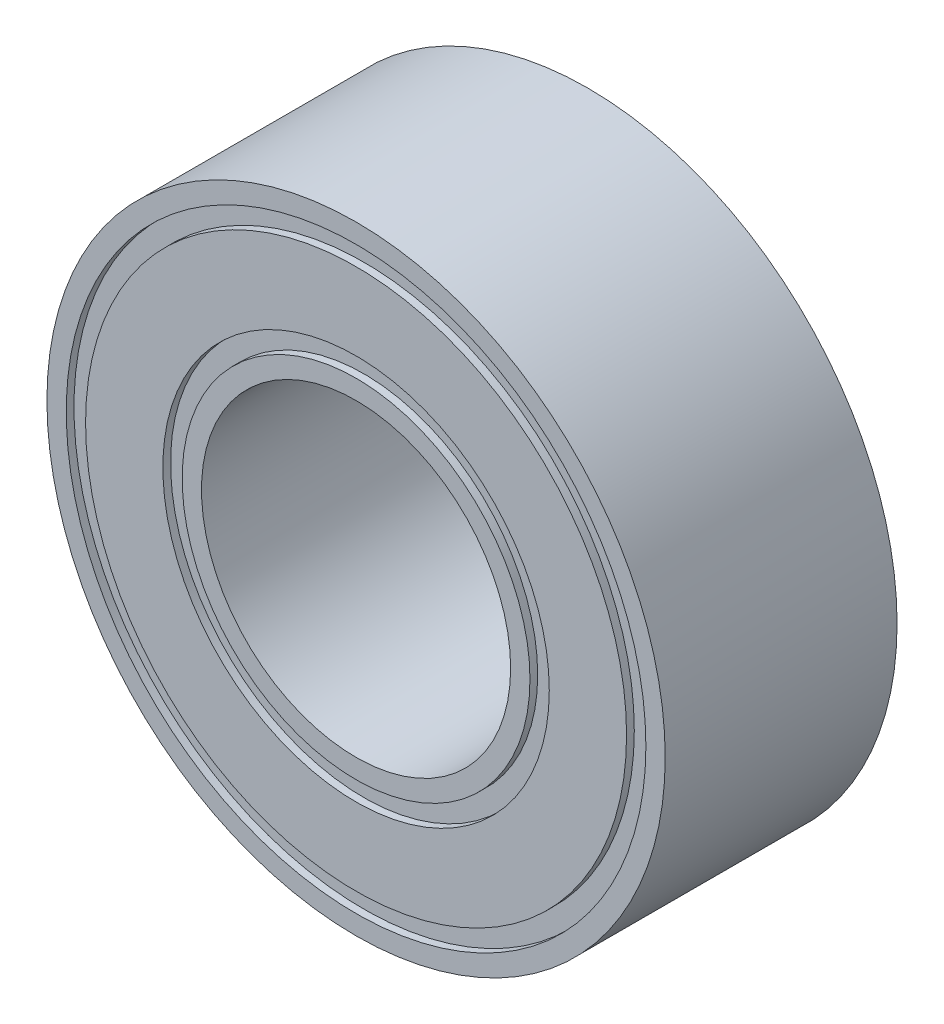
from build123d import *

# Parameters (mm, degrees)
SKETCH_1_R          = 4
SKETCH_1_R_2        = 2
EXTRUDE_1_DEPTH     = 3
SKETCH_2_R          = 3.75
SKETCH_2_R_2        = 3.5
SKETCH_2_R_3        = 2.5
SKETCH_2_R_4        = 2.25
CUT_EXTRUDE_1_DEPTH = 0.1
CUT_EXTRUDE_START   = -0.1
SKETCH_3_R          = 3.75
SKETCH_3_R_2        = 3.5
SKETCH_3_R_3        = 2.5
SKETCH_3_R_4        = 2.25
CUT_EXTRUDE_2_DEPTH = 0.1


with BuildPart() as part:
    # 草图1 → 凸台-拉伸1 (new body)
    with BuildSketch(Plane.XY):
        Circle(SKETCH_1_R)
        Circle(SKETCH_1_R_2, mode=Mode.SUBTRACT)
    extrude(amount=EXTRUDE_1_DEPTH)

    # 草图2 → 切除-拉伸1 (cut)
    # profile 1 of 2: a face of its own
    with BuildSketch(Plane.XY.offset(3)):
        Circle(SKETCH_2_R)
        Circle(SKETCH_2_R_2, mode=Mode.SUBTRACT)
    # profile 2 of 2: a face of its own
    with BuildSketch(Plane.XY.offset(3)):
        Circle(SKETCH_2_R_3)
        Circle(SKETCH_2_R_4, mode=Mode.SUBTRACT)
    extrude(amount=-CUT_EXTRUDE_1_DEPTH, mode=Mode.SUBTRACT)

    # 草图3 → 切除-拉伸2 (cut)
    # profile 1 of 2: a face of its own
    with BuildSketch(Plane(origin=(0, 0, 0), x_dir=(-1, 0, 0), z_dir=(0, 0, -1)).offset(CUT_EXTRUDE_START)):
        with Locations(Location((0, 0, 0), (0, 0, 180))):
            Circle(SKETCH_3_R)
        with Locations(Location((0, 0, 0), (0, 0, 180))):
            Circle(SKETCH_3_R_2, mode=Mode.SUBTRACT)
    # profile 2 of 2: a face of its own
    with BuildSketch(Plane(origin=(0, 0, 0), x_dir=(-1, 0, 0), z_dir=(0, 0, -1)).offset(CUT_EXTRUDE_START)):
        with Locations(Location((0, 0, 0), (0, 0, 180))):
            Circle(SKETCH_3_R_3)
        with Locations(Location((0, 0, 0), (0, 0, 180))):
            Circle(SKETCH_3_R_4, mode=Mode.SUBTRACT)
    extrude(amount=CUT_EXTRUDE_2_DEPTH, mode=Mode.SUBTRACT)


solid = part.part
